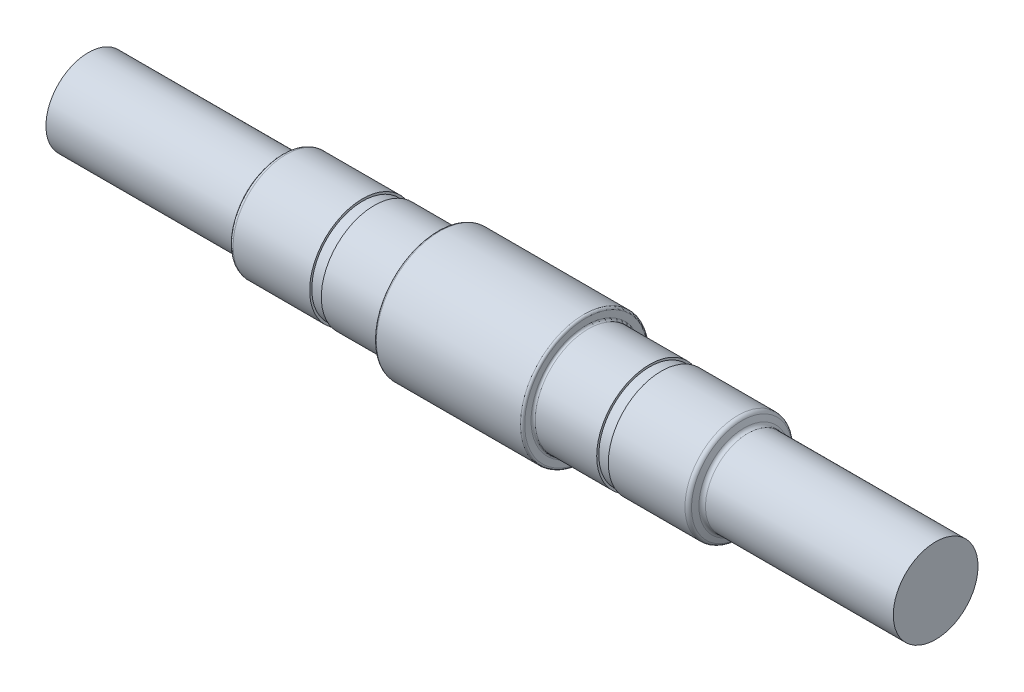
from build123d import *

# Parameters (mm, degrees)
SKETCH1_R            = 4
BOSS_EXTRUDE1_DEPTH  = 40
SKETCH2_R            = 6
BOSS_EXTRUDE2_DEPTH  = 7
SKETCH3_R            = 5
BOSS_EXTRUDE3_DEPTH  = 21.6
FILLET1_R            = 0.2
SKETCH4_R            = 8.07769614
SKETCH4_R_2          = 4.8
CUT_EXTRUDE1_DEPTH   = 1.1
FILLET3_R            = 0.4
FILLET1_OF_MIRROR1_R = 0.2
FILLET3_OF_MIRROR1_R = 0.4


with BuildPart() as part:
    # Sketch1 → Boss-Extrude1 (new body)
    with BuildSketch(Plane(origin=(0, 0, 0), x_dir=(0, 0, -1), z_dir=(1, 0, 0))):
        Circle(SKETCH1_R)
    boss_extrude1 = extrude(amount=BOSS_EXTRUDE1_DEPTH)

    # Sketch2 → Boss-Extrude2 (add)
    with BuildSketch(Plane(origin=(0, 0, 0), x_dir=(0, 0, -1), z_dir=(1, 0, 0))):
        Circle(SKETCH2_R)
    boss_extrude2 = extrude(amount=BOSS_EXTRUDE2_DEPTH)

    # Sketch3 → Boss-Extrude3 (add)
    with BuildSketch(Plane(origin=(0, 0, 0), x_dir=(0, 0, -1), z_dir=(1, 0, 0))):
        with Locations(Location((0, 0, 0), (0, 0, 180))):
            Circle(SKETCH3_R)
    boss_extrude3 = extrude(amount=BOSS_EXTRUDE3_DEPTH)

    # Fillet1
    fillet1_edges = [part.edges().sort_by_distance(p)[0] for p in [
        (7, 0, -5),
        (7, 0, 6),
    ]]
    fillet(fillet1_edges, radius=FILLET1_R)

    # Sketch4 → Cut-Extrude1 (cut)
    with BuildSketch(Plane(origin=(13, 0, 0), x_dir=(0, 0, -1), z_dir=(1, 0, 0))):
        Circle(SKETCH4_R)
        Circle(SKETCH4_R_2, mode=Mode.SUBTRACT)
    cut_extrude1 = extrude(amount=CUT_EXTRUDE1_DEPTH, mode=Mode.SUBTRACT)

    # Sketch5 → Revolve1 (revolve)
    with BuildSketch(Plane.XY, mode=Mode.PRIVATE) as revolve1_sk:
        Polygon((21.6, 5), (21.6, 4), (22.004026226, 4), align=None)
    revolve1 = revolve(revolve1_sk.sketch.rotate(Axis((21.6, 0, 0), (-1, 0, 0)), 90), axis=Axis((21.6, 0, 0), (-1, 0, 0)))

    # Fillet3
    fillet3_edges = [part.edges().sort_by_distance(p)[0] for p in [
        (21.6, 5, 0),
        (22.004026226, 0, 4),
    ]]
    fillet(fillet3_edges, radius=FILLET3_R)

    # Mirror1: Boss-Extrude1, Boss-Extrude2, Boss-Extrude3, Cut-Extrude1, Revolve1 across plane
    add(boss_extrude1.mirror(Plane(origin=(0, 0, 0), x_dir=(0, 0, 1), z_dir=(1, 0, 0))))
    add(boss_extrude2.mirror(Plane(origin=(0, 0, 0), x_dir=(0, 0, 1), z_dir=(1, 0, 0))))
    add(boss_extrude3.mirror(Plane(origin=(0, 0, 0), x_dir=(0, 0, 1), z_dir=(1, 0, 0))))
    add(cut_extrude1.mirror(Plane(origin=(0, 0, 0), x_dir=(0, 0, 1), z_dir=(1, 0, 0))), mode=Mode.SUBTRACT)
    add(revolve1.mirror(Plane(origin=(0, 0, 0), x_dir=(0, 0, 1), z_dir=(1, 0, 0))))

    # Fillet1 of Mirror1
    fillet1_of_mirror1_edges = [part.edges().sort_by_distance(p)[0] for p in [
        (-7, 0, -5),
        (-7, 0, 6),
    ]]
    fillet(fillet1_of_mirror1_edges, radius=FILLET1_OF_MIRROR1_R)

    # Fillet3 of Mirror1
    fillet3_of_mirror1_edges = [part.edges().sort_by_distance(p)[0] for p in [
        (-21.6, 5, 0),
        (-22.004026226, 0, 4),
    ]]
    fillet(fillet3_of_mirror1_edges, radius=FILLET3_OF_MIRROR1_R)


solid = part.part
